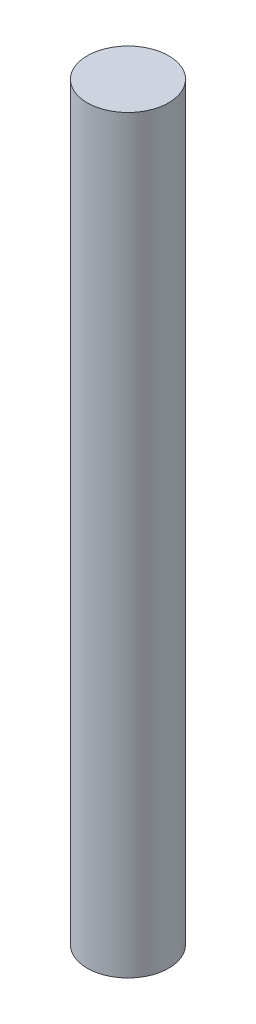
from build123d import *

# Parameters (mm, degrees)
SKETCH_1_R      = 0.5
EXTRUDE_1_DEPTH = 9.2


with BuildPart() as part:
    # 草图1 → 凸台-拉伸1 (new body)
    with BuildSketch(Plane(origin=(0, 0, 0), x_dir=(1, 0, 0), z_dir=(0, 1, 0))):
        with Locations(Location((0, 0, 0), (0, 0, 270))):
            Circle(SKETCH_1_R)
    extrude(amount=EXTRUDE_1_DEPTH)


solid = part.part
